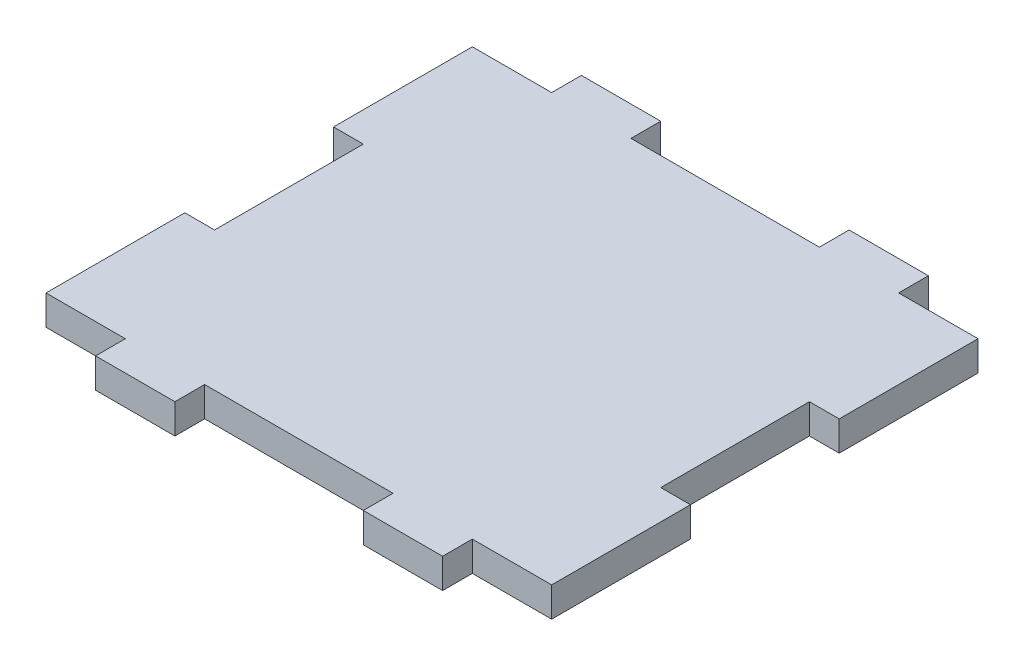
from build123d import *

# Parameters (mm, degrees)
SKETCH_1_W      = 8
SKETCH_1_H      = 3
EXTRUDE_1_DEPTH = 3


with BuildPart() as part:
    # 草图1 → 凸台-拉伸1 (new body)
    with BuildSketch(Plane(origin=(0, 0, 0), x_dir=(1, 0, 0), z_dir=(0, 1, 0))):
        Polygon((-17.5, 21.5), (-25.5, 21.5), (-25.5, 7.5), (-22.5, 7.5), (-22.5, -7.5), (-25.5, -7.5), (-25.5, -21.5), (-17.5, -21.5), (-9.5, -21.5), (9.5, -21.5), (17.5, -21.5), (25.5, -21.5), (25.5, -7.5), (22.5, -7.5), (22.5, 7.5), (25.5, 7.5), (25.5, 21.5), (17.5, 21.5), (9.5, 21.5), (-9.5, 21.5), align=None)
        with Locations((-13.5, 23)):
            Rectangle(SKETCH_1_W, SKETCH_1_H)
        with Locations((13.5, 23)):
            Rectangle(SKETCH_1_W, SKETCH_1_H)
        with Locations((13.5, -23)):
            Rectangle(SKETCH_1_W, SKETCH_1_H)
        with Locations((-13.5, -23)):
            Rectangle(SKETCH_1_W, SKETCH_1_H)
    extrude(amount=EXTRUDE_1_DEPTH)


solid = part.part
